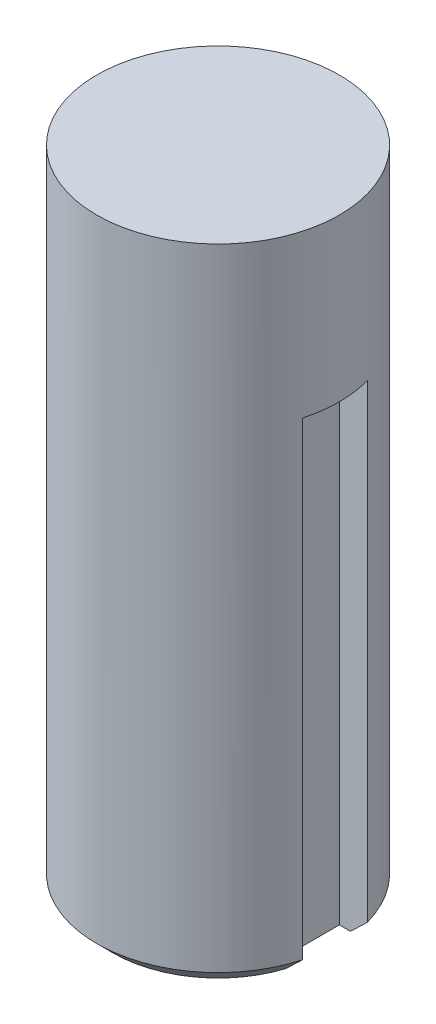
from build123d import *

# Parameters (mm, degrees)
SKETCH1_R           = 15
BOSS_EXTRUDE1_DEPTH = 80
CUT_EXTRUDE1_DEPTH  = 60
FILLET1_R           = 3
CHAMFER1_SIZE       = 2


with BuildPart() as part:
    # Sketch1 → Boss-Extrude1 (new body)
    with BuildSketch(Plane(origin=(0, 0, 0), x_dir=(1, 0, 0), z_dir=(0, 1, 0))):
        Circle(SKETCH1_R)
    extrude(amount=BOSS_EXTRUDE1_DEPTH)

    # Sketch1<3> → Cut-Extrude1 (cut)
    with BuildSketch(Plane(origin=(0, 0, 0), x_dir=(1, 0, 0), z_dir=(0, 1, 0))):
        with BuildLine():
            Line((14.456832295, 4), (11, 4))
            Line((11, 4), (11, -4))
            Line((11, -4), (14.456832295, -4))
            ThreePointArc((14.456832295, -4), (14.863587797, -2.018355219), (15, 0))
            ThreePointArc((15, 0), (14.863587797, 2.018355219), (14.456832295, 4))
        make_face()
    extrude(amount=CUT_EXTRUDE1_DEPTH, mode=Mode.SUBTRACT)

    # Fillet1
    fillet1_edges = [part.edges().sort_by_distance(p)[0] for p in [
        (11, 60, 0),
    ]]
    fillet(fillet1_edges, radius=FILLET1_R)

    # Chamfer1
    chamfer1_edges = [part.edges().sort_by_distance(p)[0] for p in [
        (-15, 0, 0),
    ]]
    chamfer(chamfer1_edges, length=CHAMFER1_SIZE)


solid = part.part
